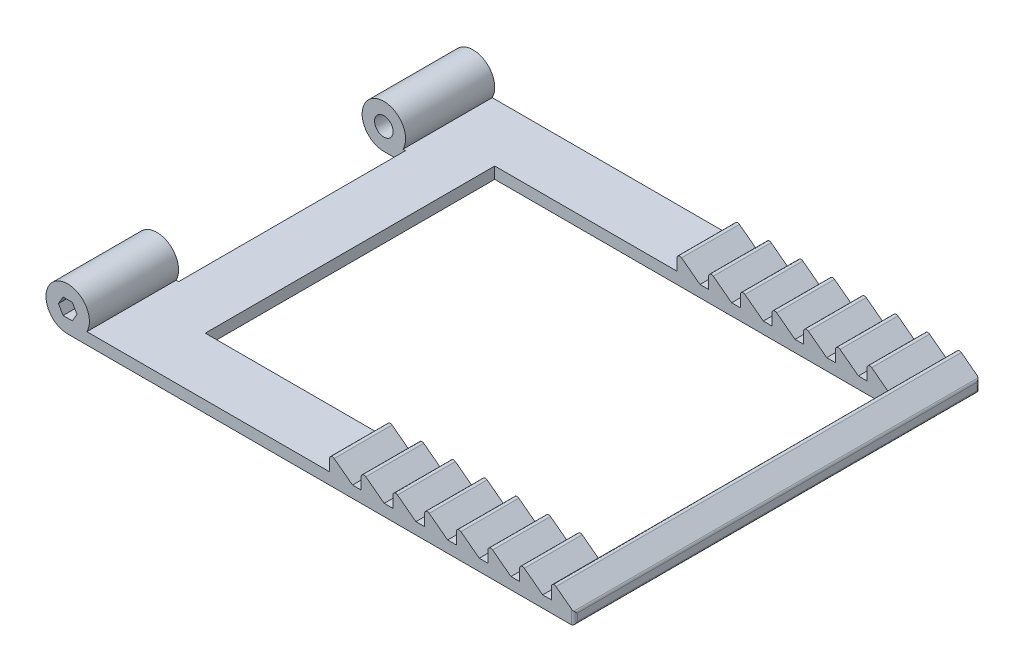
from build123d import *

# Parameters (mm, degrees)
EXTRUDE_1_DEPTH          = 140
CUT_EXTRUDE_1_DEPTH      = 20
CUT_EXTRUDE_1_DEPTH_BACK = 20
SKETCH_2_W               = 78.4
SKETCH_2_H               = 11
CUT_EXTRUDE_2_DEPTH      = 78.4
CUT_EXTRUDE_2_DEPTH_BACK = 207.820308481
SKETCH_3_R               = 3.2
FILLET_1_R               = 1
SKETCH_4_W               = 14.133249581
SKETCH_4_H               = 78.4
CUT_EXTRUDE_3_DEPTH      = 225.379143416
CUT_EXTRUDE_4_DEPTH      = 225.379143416
CUT_EXTRUDE_4_DEPTH_BACK = 225.379143416
SKETCH_5_W               = 136.544306781
SKETCH_5_H               = 100


with BuildPart() as part:
    # 草图1 → 凸台-拉伸1 (new body)
    with BuildSketch(Plane.XY):
        with BuildLine():
            Line((0, 0), (175, 0))
            Line((175, 0), (175, 4))
            Line((175, 4), (167.055676963, 10))
            Line((167.055676963, 10), (167.055676963, 4))
            Line((167.055676963, 4), (164.053399387, 4))
            Line((164.053399387, 4), (156.10907635, 10))
            Line((156.10907635, 10), (156.10907635, 4))
            Line((156.10907635, 4), (153.106798774, 4))
            Line((153.106798774, 4), (145.162475737, 10))
            Line((145.162475737, 10), (145.162475737, 4))
            Line((145.162475737, 4), (142.160198161, 4))
            Line((142.160198161, 4), (134.215875124, 10))
            Line((134.215875124, 10), (134.215875124, 4))
            Line((134.215875124, 4), (131.213597548, 4))
            Line((131.213597548, 4), (123.269274511, 10))
            Line((123.269274511, 10), (123.269274511, 4))
            Line((123.269274511, 4), (120.266996935, 4))
            Line((120.266996935, 4), (112.322673898, 10))
            Line((112.322673898, 10), (112.322673898, 4))
            Line((112.322673898, 4), (109.320396322, 4))
            Line((109.320396322, 4), (101.376073285, 10))
            Line((101.376073285, 10), (101.376073285, 4))
            Line((101.376073285, 4), (98.373795709, 4))
            Line((98.373795709, 4), (90.429472672, 10))
            Line((90.429472672, 10), (90.429472672, 4))
            Line((90.429472672, 4), (72.427195096, 4))
            Line((72.427195096, 4), (65.557646205, 4))
            Line((65.557646205, 4), (61.480594483, 4))
            Line((61.480594483, 4), (54.611045592, 4))
            Line((54.611045592, 4), (6.633249581, 4))
            ThreePointArc((6.633249581, 4), (-3.872983346, 13.922616289), (0, 0))
        make_face()
        Polygon((3.2, 7.5), (1.6, 10.271281292), (-1.6, 10.271281292), (-3.2, 7.5), (-1.6, 4.728718708), (1.6, 4.728718708), align=None, mode=Mode.SUBTRACT)
    extrude(amount=-EXTRUDE_1_DEPTH)

    # 草图2 → 切除-拉伸1 (cut, two sides: drawn at the far end of the back side and taken through both)
    with BuildSketch(Plane(origin=(0, 0, 0), x_dir=(0, 0, -1), z_dir=(1, 0, 0)).offset(-CUT_EXTRUDE_1_DEPTH_BACK)):
        with Locations((70, 9.5)):
            Rectangle(SKETCH_2_W, SKETCH_2_H)
    extrude(amount=CUT_EXTRUDE_1_DEPTH + CUT_EXTRUDE_1_DEPTH_BACK, mode=Mode.SUBTRACT)

    # 草图3 → 切除-拉伸2 (cut, two sides: drawn at the far end of the back side and taken through both)
    with BuildSketch(Plane.XY.offset(-109.2).offset(-CUT_EXTRUDE_2_DEPTH_BACK)):
        with Locations((0, 7.5)):
            Circle(SKETCH_3_R)
    extrude(amount=CUT_EXTRUDE_2_DEPTH + CUT_EXTRUDE_2_DEPTH_BACK, mode=Mode.SUBTRACT)

    # 圆角1
    fillet_1_edges = [part.edges().sort_by_distance(p)[0] for p in [
        (175, 2, -140),
        (175, 2, 0),
        (90.429472672, 10, -70),
        (101.376073285, 10, -70),
        (112.322673898, 10, -70),
        (123.269274511, 10, -70),
        (134.215875124, 10, -70),
        (145.162475737, 10, -70),
        (156.10907635, 10, -70),
        (167.055676963, 10, -70),
        (175, 4, -70),
        (175, 0, -70),
    ]]
    fillet(fillet_1_edges, radius=FILLET_1_R)

    # 草图4 → 切除-拉伸3 (cut, through all)
    with BuildSketch(Plane(origin=(0, 4, 0), x_dir=(1, 0, 0), z_dir=(0, 1, 0))):
        with Locations((0.43337521, 70)):
            Rectangle(SKETCH_4_W, SKETCH_4_H)
    extrude(amount=-CUT_EXTRUDE_3_DEPTH, mode=Mode.SUBTRACT)

    # 草图5 → 切除-拉伸4 (cut, two sides: drawn at the far end of the back side and taken through both)
    with BuildSketch(Plane(origin=(0, 4, 0), x_dir=(1, 0, 0), z_dir=(0, 1, 0)).offset(-CUT_EXTRUDE_4_DEPTH_BACK)):
        with Locations((95.772153391, 70)):
            Rectangle(SKETCH_5_W, SKETCH_5_H)
    extrude(amount=CUT_EXTRUDE_4_DEPTH + CUT_EXTRUDE_4_DEPTH_BACK, mode=Mode.SUBTRACT)


solid = part.part
